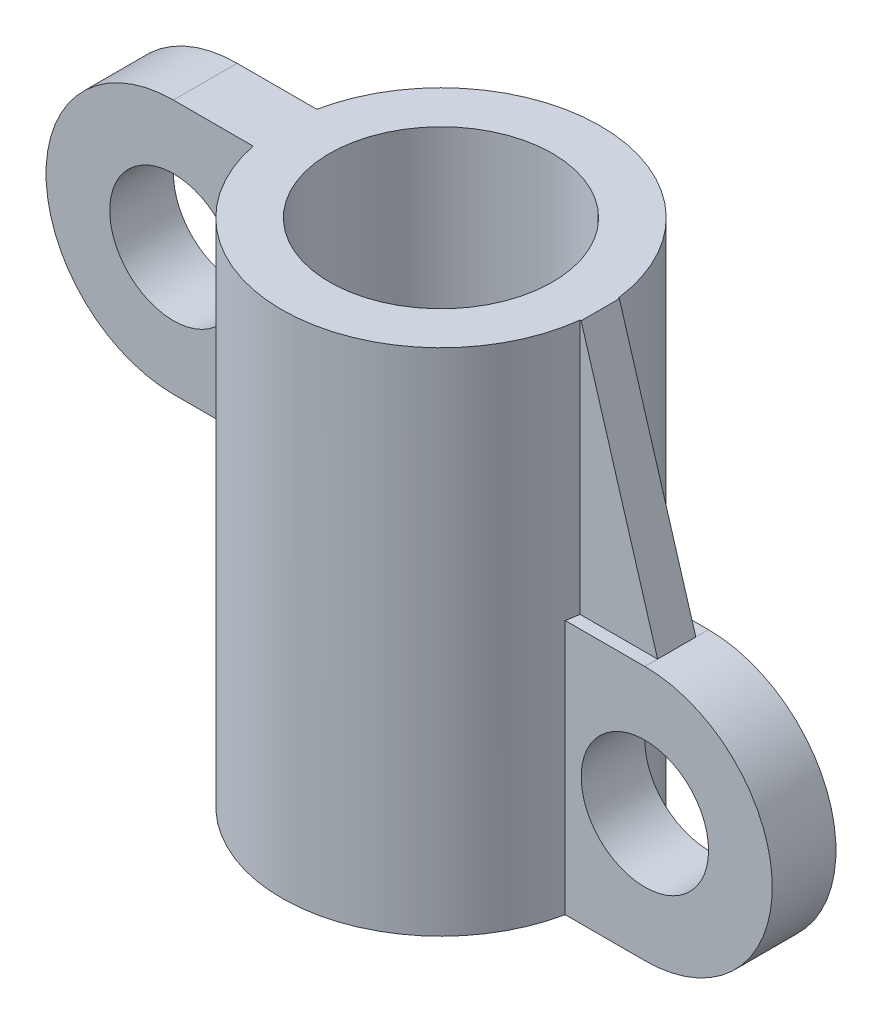
from build123d import *

# Parameters (mm, degrees)
SKETCH1_R                = 25
BOSS_EXTRUDE1_DEPTH      = 80
BOSS_EXTRUDE2_DEPTH      = 5
BOSS_EXTRUDE2_DEPTH_BACK = 5
SKETCH2_R                = 10
BOSS_EXTRUDE3_DEPTH      = 5
BOSS_EXTRUDE3_DEPTH_BACK = 5
SKETCH3_R                = 10
BOSS_EXTRUDE4_DEPTH      = 3
BOSS_EXTRUDE4_DEPTH_BACK = 3
SKETCH5_R                = 17.5
CUT_EXTRUDE10_DEPTH      = 80


with BuildPart() as part:
    # Sketch1 → Boss-Extrude1 (new body)
    with BuildSketch(Plane(origin=(0, 0, 0), x_dir=(1, 0, 0), z_dir=(0, 1, 0))):
        Circle(SKETCH1_R)
    extrude(amount=BOSS_EXTRUDE1_DEPTH)

    # Sketch2 → Boss-Extrude2 (add, two sides: drawn at the far end of the back side and taken through both)
    with BuildSketch(Plane.XY.offset(-BOSS_EXTRUDE2_DEPTH_BACK)):
        with BuildLine():
            Line((0, 80), (-37, 80))
            ThreePointArc((-37, 80), (-57, 60), (-37, 40))
            Line((-37, 40), (0, 40))
            Line((0, 40), (0, 80))
        make_face()
        with Locations((-37, 60)):
            Circle(SKETCH2_R, mode=Mode.SUBTRACT)
    extrude(amount=BOSS_EXTRUDE2_DEPTH + BOSS_EXTRUDE2_DEPTH_BACK)

    # Sketch3 → Boss-Extrude3 (add, two sides: drawn at the far end of the back side and taken through both)
    with BuildSketch(Plane.XY.offset(-BOSS_EXTRUDE3_DEPTH_BACK)):
        with BuildLine():
            Line((0, 0), (37, 0))
            ThreePointArc((37, 0), (57, 20), (37, 40))
            Line((37, 40), (0, 40))
            Line((0, 40), (0, 0))
        make_face()
        with Locations((37, 20)):
            Circle(SKETCH3_R, mode=Mode.SUBTRACT)
    extrude(amount=BOSS_EXTRUDE3_DEPTH + BOSS_EXTRUDE3_DEPTH_BACK)

    # Sketch4 → Boss-Extrude4 (add, two sides: drawn at the far end of the back side and taken through both)
    with BuildSketch(Plane.XY.offset(-BOSS_EXTRUDE4_DEPTH_BACK)):
        Polygon((25, 80), (37, 40), (0.252551286, 40), (0.252551286, 80), align=None)
    extrude(amount=BOSS_EXTRUDE4_DEPTH + BOSS_EXTRUDE4_DEPTH_BACK)

    # Sketch5 → Cut-Extrude10 (cut)
    with BuildSketch(Plane(origin=(0, 0, 0), x_dir=(1, 0, 0), z_dir=(0, 1, 0))):
        Circle(SKETCH5_R)
    extrude(amount=CUT_EXTRUDE10_DEPTH, mode=Mode.SUBTRACT)


solid = part.part
